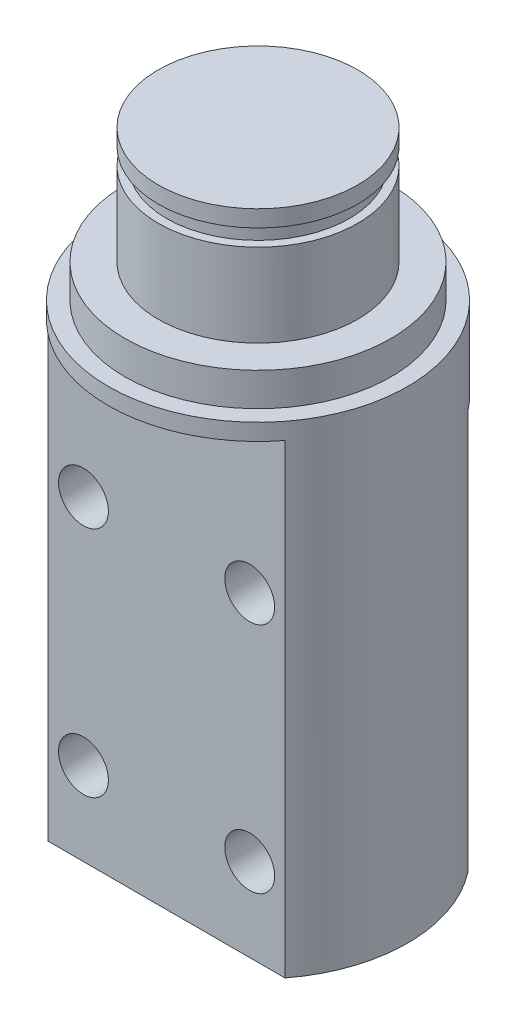
from build123d import *

# Parameters (mm, degrees)
SKETCH_1_R          = 6
EXTRUDE_1_DEPTH     = 7
SKETCH_2_R          = 9
EXTRUDE_2_DEPTH     = 31
SKETCH_3_W          = 19.613357353
SKETCH_3_H          = 3.5
CUT_EXTRUDE_1_DEPTH = 24
SKETCH_4_W          = 20.018720859
SKETCH_4_H          = 3.5
CUT_EXTRUDE_2_DEPTH = 28
SKETCH_5_R          = 1.5
CUT_EXTRUDE_3_DEPTH = 18
SKETCH_11_R         = 10.638163441
SKETCH_11_R_2       = 5.5
CUT_EXTRUDE_4_DEPTH = 1
SKETCH_12_R         = 9
SKETCH_12_R_2       = 8
CUT_EXTRUDE_7_DEPTH = 2


with BuildPart() as part:
    # 草图1 → 凸台-拉伸1 (new body)
    with BuildSketch(Plane(origin=(0, 0, 0), x_dir=(1, 0, 0), z_dir=(0, 1, 0))):
        with Locations(Location((0, 0, 0), (0, 0, 270))):
            Circle(SKETCH_1_R)
    extrude(amount=EXTRUDE_1_DEPTH)

    # 草图2 → 凸台-拉伸2 (add)
    with BuildSketch(Plane.XZ):
        with Locations(Location((0, 0, 0), (0, 0, 270))):
            Circle(SKETCH_2_R)
    extrude(amount=EXTRUDE_2_DEPTH)

    # 草图3 → 切除-拉伸1 (cut)
    with BuildSketch(Plane.XZ.offset(31)):
        with Locations((1.075772383, -7.25)):
            Rectangle(SKETCH_3_W, SKETCH_3_H)
    extrude(amount=-CUT_EXTRUDE_1_DEPTH, mode=Mode.SUBTRACT)

    # 草图4 → 切除-拉伸2 (cut)
    with BuildSketch(Plane.XZ.offset(31)):
        with Locations((1.37199956, 7.25)):
            Rectangle(SKETCH_4_W, SKETCH_4_H)
    extrude(amount=-CUT_EXTRUDE_2_DEPTH, mode=Mode.SUBTRACT)

    # 草图5 → 切除-拉伸3 (cut)
    with BuildSketch(Plane(origin=(0, 0, -5.5), x_dir=(-1, 0, 0), z_dir=(0, 0, -1))):
        with Locations((-5, -26)):
            Circle(SKETCH_5_R)
        with Locations((5, -26)):
            Circle(SKETCH_5_R)
        with Locations((5, -12)):
            Circle(SKETCH_5_R)
        with Locations((-5, -12)):
            Circle(SKETCH_5_R)
    extrude(amount=-CUT_EXTRUDE_3_DEPTH, mode=Mode.SUBTRACT)

    # 草图11 → 切除-拉伸4 (cut)
    with BuildSketch(Plane(origin=(0, 6, 0), x_dir=(1, 0, 0), z_dir=(0, 1, 0))):
        Circle(SKETCH_11_R)
        with Locations(Location((0, 0, 0), (0, 0, 270))):
            Circle(SKETCH_11_R_2, mode=Mode.SUBTRACT)
    extrude(amount=-CUT_EXTRUDE_4_DEPTH, mode=Mode.SUBTRACT)

    # 草图12 → 切除-拉伸7 (cut)
    with BuildSketch(Plane(origin=(0, 0, 0), x_dir=(1, 0, 0), z_dir=(0, 1, 0))):
        with Locations(Location((0, 0, 0), (0, 0, 270))):
            Circle(SKETCH_12_R)
        with Locations(Location((0, 0, 0), (0, 0, 270))):
            Circle(SKETCH_12_R_2, mode=Mode.SUBTRACT)
    extrude(amount=-CUT_EXTRUDE_7_DEPTH, mode=Mode.SUBTRACT)


solid = part.part
